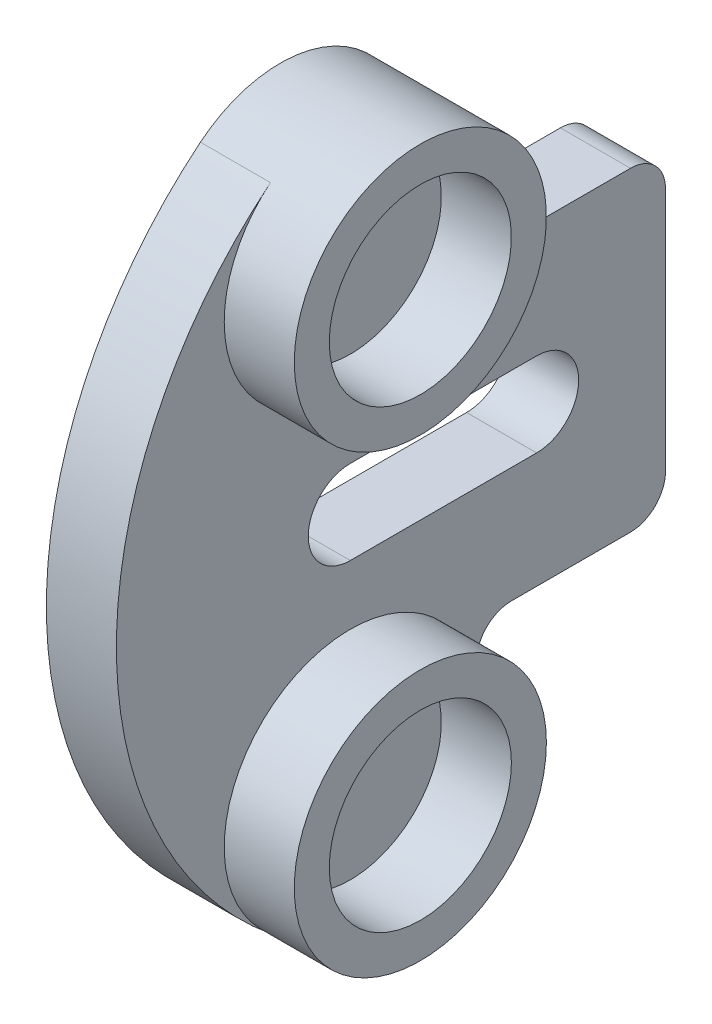
from build123d import *

# Parameters (mm, degrees)
BOSS_EXTRUDE1_DEPTH = 10
SKETCH3_R           = 18
SKETCH3_R_2         = 13
BOSS_EXTRUDE2_DEPTH = 20


with BuildPart() as part:
    # Sketch2 → Boss-Extrude1 (new body)
    with BuildSketch(Plane.YZ):
        with BuildLine():
            Line((32.5, 8.603571189), (27.5, 8.603571189))
            ThreePointArc((27.5, 8.603571189), (23.964466094, 7.139105095), (22.5, 3.603571189))
            Line((22.5, 3.603571189), (22.5, -13.396428811))
            ThreePointArc((22.5, -13.396428811), (21.035533906, -16.931962717), (17.5, -18.396428811))
            Line((17.5, -18.396428811), (-17.5, -18.396428811))
            ThreePointArc((-17.5, -18.396428811), (-21.035533906, -16.931962717), (-22.5, -13.396428811))
            Line((-22.5, -13.396428811), (-22.5, 3.603571189))
            ThreePointArc((-22.5, 3.603571189), (-23.964466094, 7.139105095), (-27.5, 8.603571189))
            Line((-27.5, 8.603571189), (-32.5, 8.603571189))
            ThreePointArc((-32.5, 8.603571189), (-48.766953451, 18.897325318), (-46.428571429, 38.005101698))
            ThreePointArc((-46.428571429, 38.005101698), (0, 60), (46.428571429, 38.005101698))
            ThreePointArc((46.428571429, 38.005101698), (48.766953451, 18.897325318), (32.5, 8.603571189))
        make_face()
        with BuildLine():
            Line((6, 26.603571189), (6, 0))
            ThreePointArc((6, 0), (0, -6), (-6, 0))
            Line((-6, 0), (-6, 26.603571189))
            ThreePointArc((-6, 26.603571189), (0, 32.603571189), (6, 26.603571189))
        make_face(mode=Mode.SUBTRACT)
    extrude(amount=BOSS_EXTRUDE1_DEPTH)

    # Sketch3 → Boss-Extrude2 (add)
    # profile 1 of 2: a face of its own
    with BuildSketch(Plane.YZ):
        with Locations(Location((-32.5, 26.603571189, 0), (0, 0, 270))):
            Circle(SKETCH3_R)
        with Locations(Location((-32.5, 26.603571189, 0), (0, 0, 90))):
            Circle(SKETCH3_R_2, mode=Mode.SUBTRACT)
    # profile 2 of 2: a face of its own
    with BuildSketch(Plane.YZ):
        with Locations(Location((32.5, 26.603571189, 0), (0, 0, 90))):
            Circle(SKETCH3_R)
        with Locations(Location((32.5, 26.603571189, 0), (0, 0, 90))):
            Circle(SKETCH3_R_2, mode=Mode.SUBTRACT)
    extrude(amount=BOSS_EXTRUDE2_DEPTH)


solid = part.part
